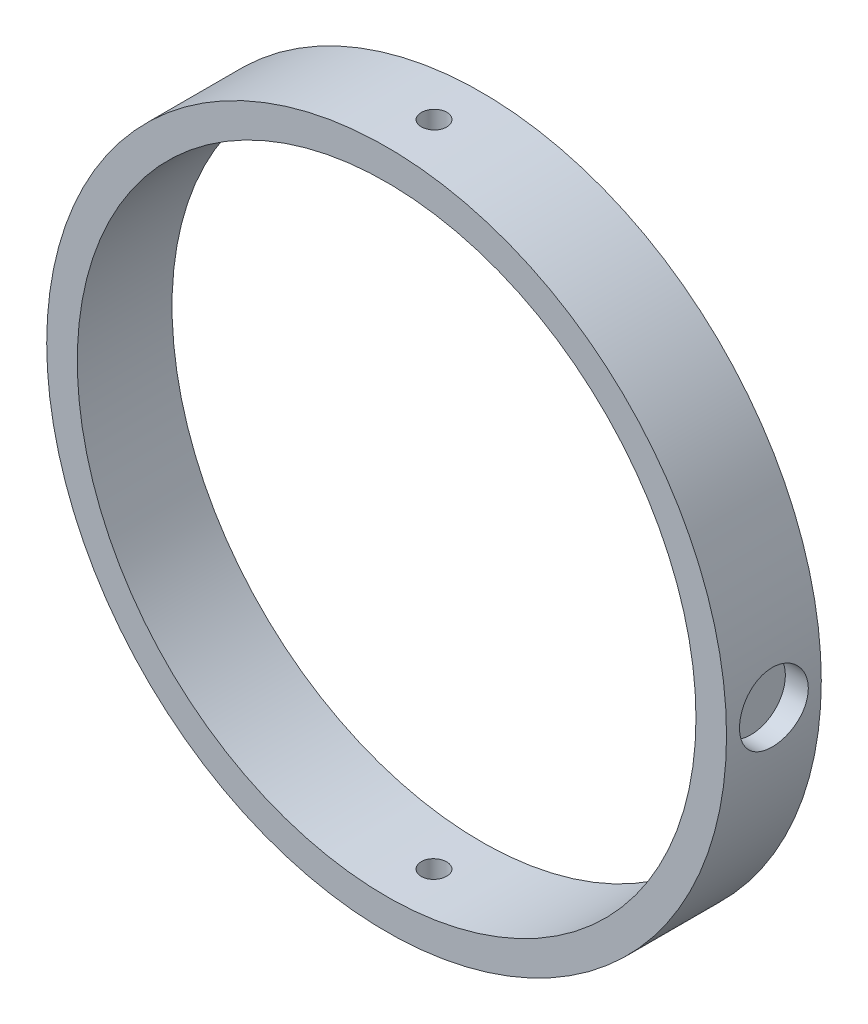
from build123d import *

# Parameters (mm, degrees)
ESBO_O2_R                                    = 111.2
ESBO_O2_R_2                                  = 101.2
RESSALTO_EXTRUS_O1_DEPTH                     = 31
FURO_ROSCADO_PARA_CONDU_TE_DE_M8X1_251_REACH = 251.133
FURO_ROSCADO_PARA_CONDU_TE_DE_M8X1_251_B_R   = 4.15
FURO_ROSCADO_PARA_CONDU_TE_DE_M8X1_252_D     = 8.3
FURO_ROSCADO_PARA_CONDU_TE_DE_M8X1_252_DEPTH = 212.401
ESBO_O12_R                                   = 11.25
CORTE_EXTRUS_O1_DEPTH                        = 7.5


with BuildPart() as part:
    # Esboço2 → Ressalto-extrusão1 (new body)
    with BuildSketch(Plane.XY):
        Circle(ESBO_O2_R)
        Circle(ESBO_O2_R_2, mode=Mode.SUBTRACT)
    extrude(amount=RESSALTO_EXTRUS_O1_DEPTH)

    # Furo roscado para conduíte de M8x1.251 b (on position points) → Furo roscado para conduíte de M8x1.251 (cut, up to next)
    with BuildSketch(Plane(origin=(0, 111.2, 15.5), x_dir=(1, 0, 0), z_dir=(0, 1, 0)), mode=Mode.PRIVATE) as furo_roscado_para_condu_te_de_m8x1_251_sk1:
        Circle(FURO_ROSCADO_PARA_CONDU_TE_DE_M8X1_251_B_R)
    furo_roscado_para_condu_te_de_m8x1_251_tool1 = extrude(furo_roscado_para_condu_te_de_m8x1_251_sk1.sketch, amount=-FURO_ROSCADO_PARA_CONDU_TE_DE_M8X1_251_REACH, mode=Mode.PRIVATE) & part.part
    add(furo_roscado_para_condu_te_de_m8x1_251_tool1.solids().sort_by_distance((0, 111.2, 15.5))[0], mode=Mode.SUBTRACT)

    # Furo roscado para conduíte de M8x1.252
    with Locations(Plane(origin=(0, -111.2, 15.5), x_dir=(-1, 0, 0), z_dir=(0, -1, 0))):
        with Locations((0, 0)):
            Hole(FURO_ROSCADO_PARA_CONDU_TE_DE_M8X1_252_D / 2, depth=FURO_ROSCADO_PARA_CONDU_TE_DE_M8X1_252_DEPTH)

    # Esboço12 → Corte-extrusão1 (cut)
    with BuildSketch(Plane(origin=(111.2, 0, 0), x_dir=(0, 0, -1), z_dir=(1, 0, 0))):
        with Locations((-15.5, 0)):
            Circle(ESBO_O12_R)
    corte_extrus_o1 = extrude(amount=-CORTE_EXTRUS_O1_DEPTH, mode=Mode.SUBTRACT)

    # Espelhar1: Corte-extrusão1 across plane
    add(corte_extrus_o1.mirror(Plane(origin=(0, 0, 0), x_dir=(0, 0, 1), z_dir=(1, 0, 0))), mode=Mode.SUBTRACT)


solid = part.part
